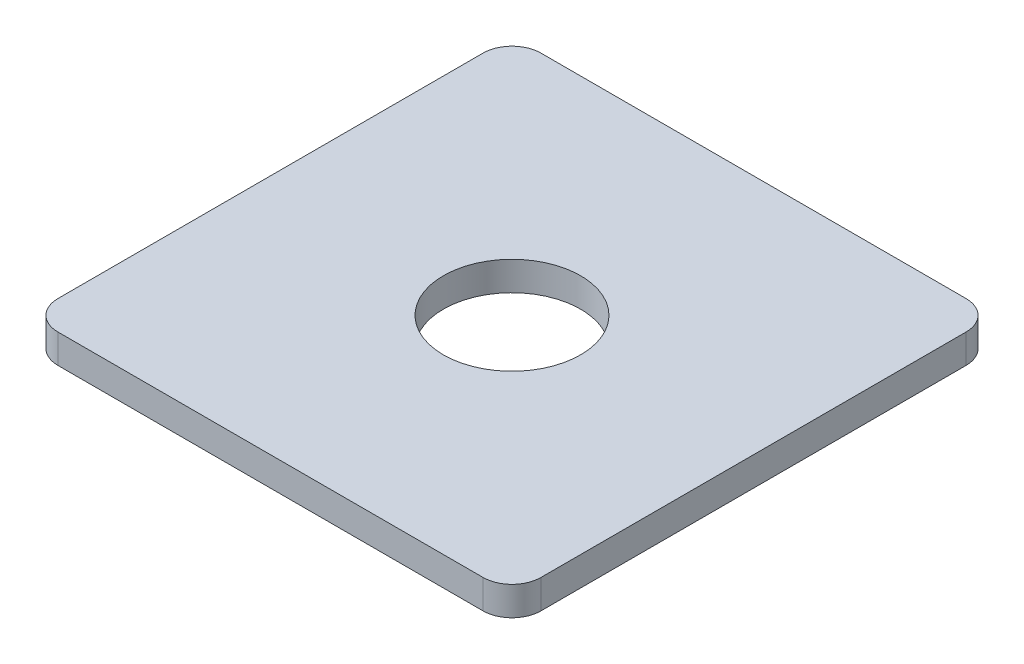
from build123d import *

# Parameters (mm, degrees)
SKETCH_1_W                = 50
SKETCH_1_H                = 3
BLOCKEXTRUDE_DEPTH        = 50
FILLET_2_R                = 3
SKETCH_2_R                = 7.1
COAXIAL_FEEDTHROUGH_DEPTH = 71.774289117


with BuildPart() as part:
    # 草图1 → BlockExtrude (new body)
    with BuildSketch(Plane.XY):
        with Locations((25, 1.5)):
            Rectangle(SKETCH_1_W, SKETCH_1_H)
    extrude(amount=BLOCKEXTRUDE_DEPTH)

    # Fillet 2
    fillet_2_edges = [part.edges().sort_by_distance(p)[0] for p in [
        (50, 1.5, 50),
        (0, 1.5, 50),
        (50, 1.5, 0),
        (0, 1.5, 0),
    ]]
    fillet(fillet_2_edges, radius=FILLET_2_R)

    # 草图2 → Coaxial_feedthrough (cut, through all)
    with BuildSketch(Plane(origin=(0, 3, 0), x_dir=(1, 0, 0), z_dir=(0, 1, 0))):
        with Locations(Location((25, -25, 0), (0, 0, 270))):
            Circle(SKETCH_2_R)
    extrude(amount=-COAXIAL_FEEDTHROUGH_DEPTH, mode=Mode.SUBTRACT)


solid = part.part
